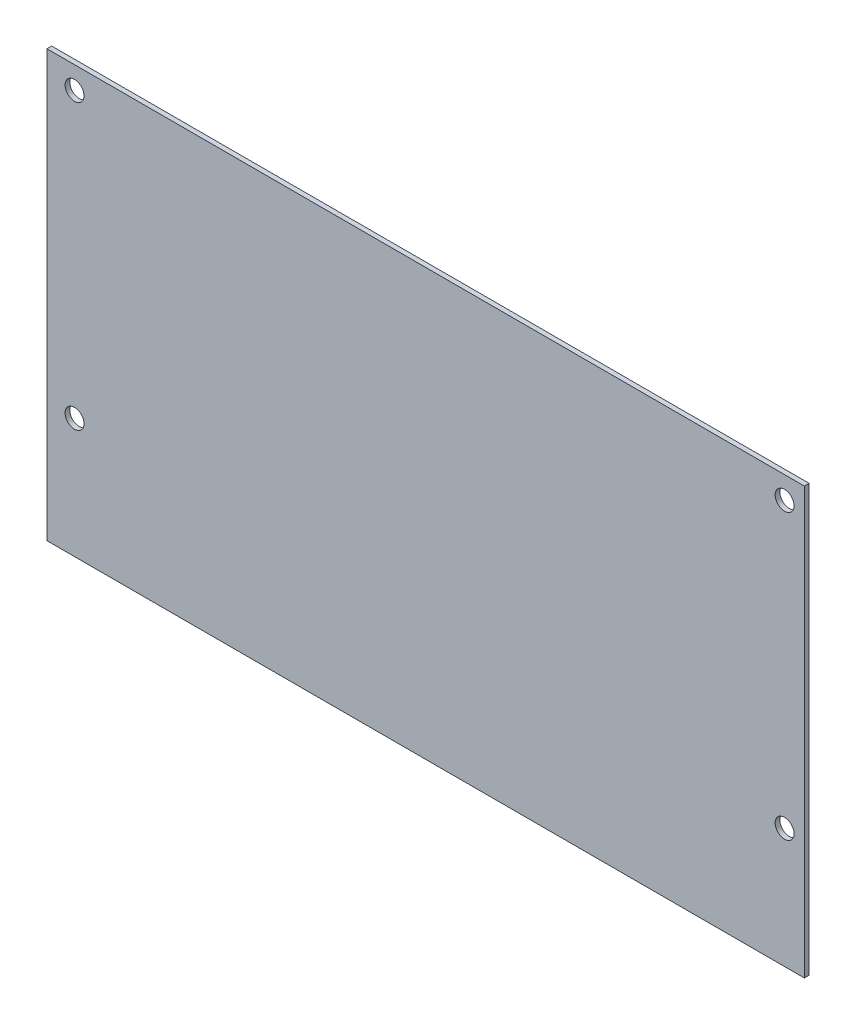
from build123d import *

# Parameters (mm, degrees)
SCHIZZO1_W                   = 160
SCHIZZO1_H                   = 90
ESTRUSIONE_ESTRUSIONE1_DEPTH = 1
TAGLIO_ESTRUSIONE1_DEPTH     = 10


with BuildPart() as part:
    # Schizzo1 → Estrusione-Estrusione1 (new body)
    with BuildSketch(Plane.XY):
        with Locations((80, 45)):
            Rectangle(SCHIZZO1_W, SCHIZZO1_H)
    extrude(amount=ESTRUSIONE_ESTRUSIONE1_DEPTH)

    # Schizzo3 → Taglio-Estrusione1 (cut)
    with BuildSketch(Plane.XY.offset(1)):
        with BuildLine():
            Line((5.83216523, 83.300482418), (5.83216523, 85.300482418))
            Line((5.83216523, 85.300482418), (7.83216523, 85.300482418))
            ThreePointArc((7.83216523, 85.300482418), (4.417951668, 86.714695981), (5.83216523, 83.300482418))
        make_face()
        with BuildLine():
            Line((7.83216523, 85.300482418), (5.83216523, 85.300482418))
            Line((5.83216523, 85.300482418), (5.83216523, 83.300482418))
            ThreePointArc((5.83216523, 83.300482418), (7.246378792, 83.886268856), (7.83216523, 85.300482418))
        make_face()
        with BuildLine():
            ThreePointArc((157.83216523, 85.300482418), (155.83216523, 87.300482418), (153.83216523, 85.300482418))
            Line((153.83216523, 85.300482418), (155.83216523, 85.300482418))
            Line((155.83216523, 85.300482418), (155.83216523, 83.300482418))
            ThreePointArc((155.83216523, 83.300482418), (157.246378792, 83.886268856), (157.83216523, 85.300482418))
        make_face()
        with BuildLine():
            Line((155.83216523, 85.300482418), (153.83216523, 85.300482418))
            ThreePointArc((153.83216523, 85.300482418), (154.417951668, 83.886268856), (155.83216523, 83.300482418))
            Line((155.83216523, 83.300482418), (155.83216523, 85.300482418))
        make_face()
        with BuildLine():
            ThreePointArc((157.83216523, 25.300482418), (157.246378792, 26.714695981), (155.83216523, 27.300482418))
            Line((155.83216523, 27.300482418), (155.83216523, 25.300482418))
            Line((155.83216523, 25.300482418), (153.83216523, 25.300482418))
            ThreePointArc((153.83216523, 25.300482418), (155.83216523, 23.300482418), (157.83216523, 25.300482418))
        make_face()
        with BuildLine():
            Line((155.83216523, 25.300482418), (155.83216523, 27.300482418))
            ThreePointArc((155.83216523, 27.300482418), (154.417951668, 26.714695981), (153.83216523, 25.300482418))
            Line((153.83216523, 25.300482418), (155.83216523, 25.300482418))
        make_face()
        with BuildLine():
            ThreePointArc((7.83216523, 25.300482418), (7.246378792, 26.714695981), (5.83216523, 27.300482418))
            Line((5.83216523, 27.300482418), (5.83216523, 25.300482418))
            Line((5.83216523, 25.300482418), (7.83216523, 25.300482418))
        make_face()
        with BuildLine():
            Line((5.83216523, 25.300482418), (5.83216523, 27.300482418))
            ThreePointArc((5.83216523, 27.300482418), (4.417951668, 23.886268856), (7.83216523, 25.300482418))
            Line((7.83216523, 25.300482418), (5.83216523, 25.300482418))
        make_face()
    extrude(amount=-TAGLIO_ESTRUSIONE1_DEPTH, mode=Mode.SUBTRACT)


solid = part.part
